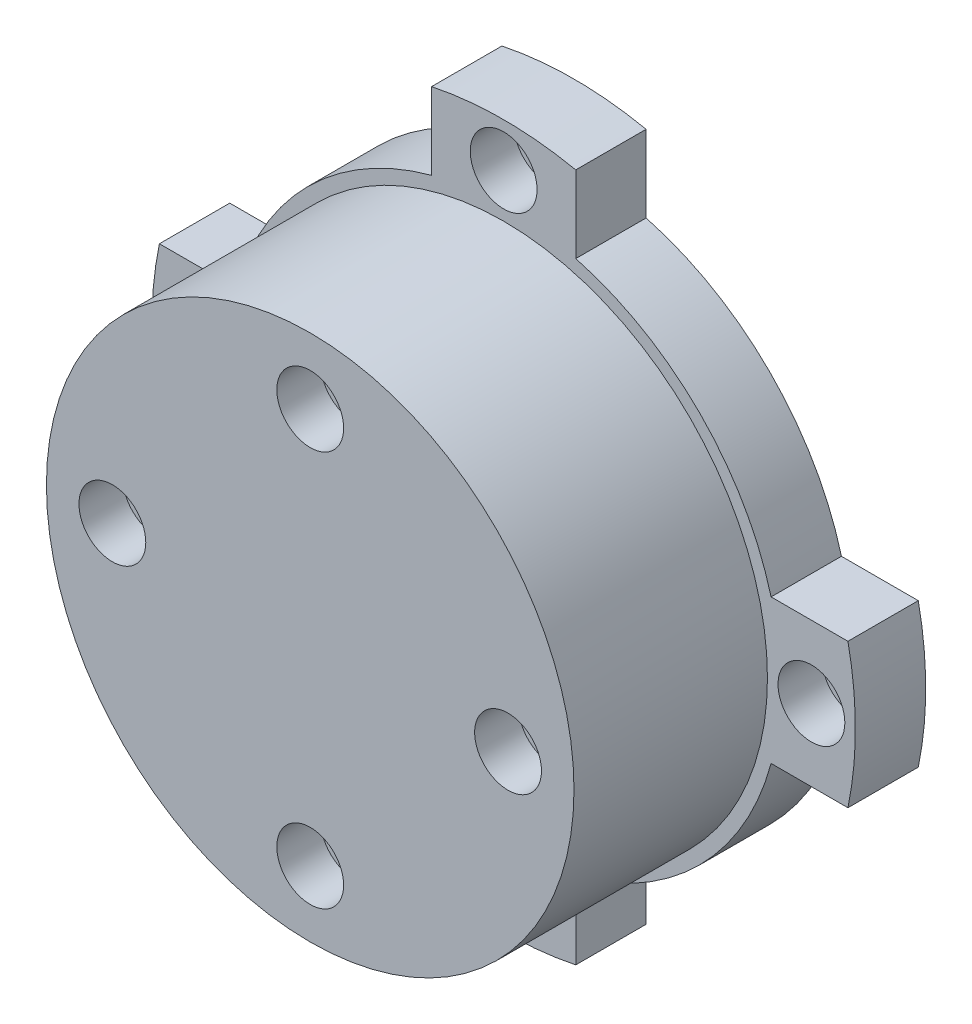
from build123d import *

# Parameters (mm, degrees)
BOSS_EXTRUDE1_DEPTH = 8
SKETCH2_R           = 30
BOSS_EXTRUDE2_DEPTH = 22
SKETCH3_R           = 3.8
CUT_EXTRUDE1_DEPTH  = 5
SKETCH4_R           = 3.8
CUT_EXTRUDE2_DEPTH  = 5


with BuildPart() as part:
    # Sketch1 → Boss-Extrude1 (new body)
    with BuildSketch(Plane.XY):
        with BuildLine():
            Line((-8.2, 39.150478924), (-8.2, 30.41397705))
            ThreePointArc((-8.2, 30.41397705), (-22.273863607, 22.273863607), (-30.41397705, 8.2))
            Line((-30.41397705, 8.2), (-39.150478924, 8.2))
            ThreePointArc((-39.150478924, 8.2), (-40, 0), (-39.150478924, -8.2))
            Line((-39.150478924, -8.2), (-30.41397705, -8.2))
            ThreePointArc((-30.41397705, -8.2), (-22.273863607, -22.273863607), (-8.2, -30.41397705))
            Line((-8.2, -30.41397705), (-8.2, -39.150478924))
            ThreePointArc((-8.2, -39.150478924), (0, -40), (8.2, -39.150478924))
            Line((8.2, -39.150478924), (8.2, -30.41397705))
            ThreePointArc((8.2, -30.41397705), (22.273863607, -22.273863607), (30.41397705, -8.2))
            Line((30.41397705, -8.2), (39.150478924, -8.2))
            ThreePointArc((39.150478924, -8.2), (40, 0), (39.150478924, 8.2))
            Line((39.150478924, 8.2), (30.41397705, 8.2))
            ThreePointArc((30.41397705, 8.2), (22.273863607, 22.273863607), (8.2, 30.41397705))
            Line((8.2, 30.41397705), (8.2, 39.150478924))
            ThreePointArc((8.2, 39.150478924), (0, 40), (-8.2, 39.150478924))
        make_face()
    extrude(amount=BOSS_EXTRUDE1_DEPTH)

    # Sketch2 → Boss-Extrude2 (add)
    with BuildSketch(Plane.XY.offset(8)):
        Circle(SKETCH2_R)
    extrude(amount=BOSS_EXTRUDE2_DEPTH)

    # Sketch3 → Cut-Extrude1 (cut)
    with BuildSketch(Plane.XY.offset(8)):
        with Locations((0, 35)):
            Circle(SKETCH3_R)
        with Locations((35, 0)):
            Circle(SKETCH3_R)
        with Locations((0, -35)):
            Circle(SKETCH3_R)
        with Locations((-35, 0)):
            Circle(SKETCH3_R)
    extrude(amount=-CUT_EXTRUDE1_DEPTH, mode=Mode.SUBTRACT)

    # Sketch4 → Cut-Extrude2 (cut)
    with BuildSketch(Plane.XY.offset(30)):
        with Locations((0, 22.5)):
            Circle(SKETCH4_R)
        with Locations((22.5, 0)):
            Circle(SKETCH4_R)
        with Locations((0, -22.5)):
            Circle(SKETCH4_R)
        with Locations((-22.5, 0)):
            Circle(SKETCH4_R)
    extrude(amount=-CUT_EXTRUDE2_DEPTH, mode=Mode.SUBTRACT)


solid = part.part
